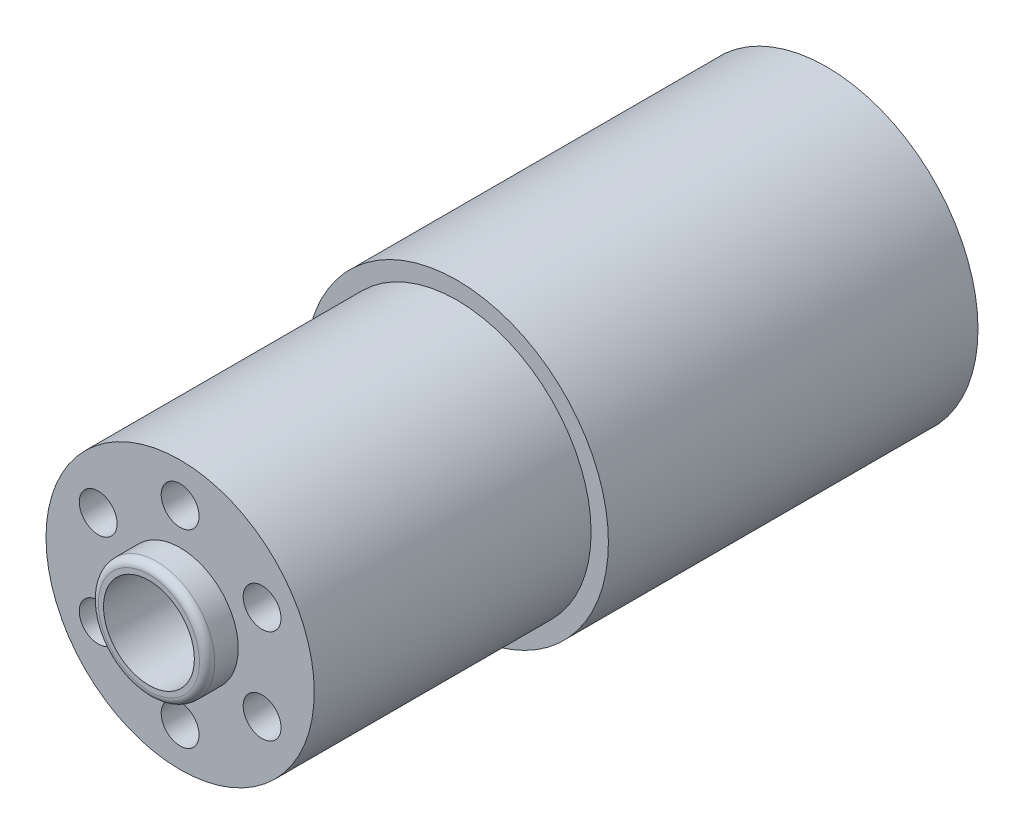
from build123d import *

# Parameters (mm, degrees)
SKETCH1_R           = 25.4
SKETCH1_R_2         = 7.62
SKETCH1_R_3         = 3.175
BOSS_EXTRUDE1_DEPTH = 108.44022
SKETCH2_R           = 9.75
SKETCH2_R_2         = 7.62
BOSS_EXTRUDE2_DEPTH = 5.2324
BOSS_EXTRUDE3_START = 4.4577
SKETCH3_R           = 9.75
SKETCH3_R_2         = 7.62
BOSS_EXTRUDE3_DEPTH = 4.4577
FILLET2_R           = 1.27
FILLET3_R           = 1.27
SKETCH4_W           = 46.4402
SKETCH4_H           = 2.9


with BuildPart() as part:
    # Sketch1 → Boss-Extrude1 (new body)
    with BuildSketch(Plane.XY):
        Circle(SKETCH1_R)
        Circle(SKETCH1_R_2, mode=Mode.SUBTRACT)
        with Locations((0, 15.875)):
            Circle(SKETCH1_R_3, mode=Mode.SUBTRACT)
        with Locations((13.748153285, 7.9375)):
            Circle(SKETCH1_R_3, mode=Mode.SUBTRACT)
        with Locations((13.748153285, -7.9375)):
            Circle(SKETCH1_R_3, mode=Mode.SUBTRACT)
        with Locations((0, -15.875)):
            Circle(SKETCH1_R_3, mode=Mode.SUBTRACT)
        with Locations((-13.748153285, -7.9375)):
            Circle(SKETCH1_R_3, mode=Mode.SUBTRACT)
        with Locations((-13.748153285, 7.9375)):
            Circle(SKETCH1_R_3, mode=Mode.SUBTRACT)
    extrude(amount=BOSS_EXTRUDE1_DEPTH)

    # Sketch2 → Boss-Extrude2 (add)
    with BuildSketch(Plane.XY.offset(108.44022)):
        Circle(SKETCH2_R)
        Circle(SKETCH2_R_2, mode=Mode.SUBTRACT)
    extrude(amount=BOSS_EXTRUDE2_DEPTH)

    # Sketch3 → Boss-Extrude3 (add)
    with BuildSketch(Plane(origin=(0, 0, 0), x_dir=(-1, 0, 0), z_dir=(0, 0, -1)).offset(BOSS_EXTRUDE3_START)):
        with Locations(Location((0, 0, 0), (0, 0, 180))):
            Circle(SKETCH3_R)
        Circle(SKETCH3_R_2, mode=Mode.SUBTRACT)
    extrude(amount=-BOSS_EXTRUDE3_DEPTH)

    # Fillet2
    fillet2_edges = [part.edges().sort_by_distance(p)[0] for p in [
        (-9.75, 0, -4.4577),
    ]]
    fillet(fillet2_edges, radius=FILLET2_R)

    # Fillet3
    fillet3_edges = [part.edges().sort_by_distance(p)[0] for p in [
        (-9.75, 0, 113.67262),
    ]]
    fillet(fillet3_edges, radius=FILLET3_R)

    # Sketch4 → Cut-Revolve1 (revolve, cut)
    with BuildSketch(Plane(origin=(0, 0, 0), x_dir=(0, 0, -1), z_dir=(1, 0, 0)), mode=Mode.PRIVATE) as cut_revolve1_sk:
        with Locations((-85.22012, 23.95)):
            Rectangle(SKETCH4_W, SKETCH4_H)
    revolve(cut_revolve1_sk.sketch.rotate(Axis((0, 0, 0), (0, 0, 1)), 90), axis=Axis((0, 0, 0), (0, 0, 1)), mode=Mode.SUBTRACT)


solid = part.part
